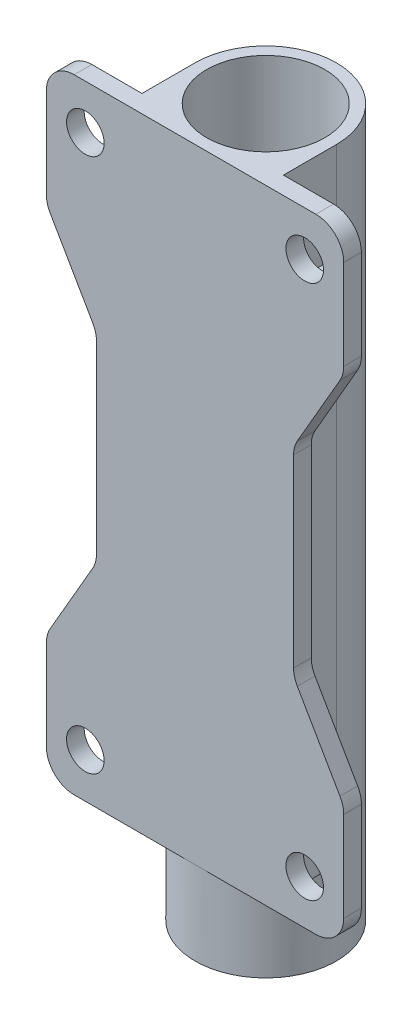
from build123d import *

# Parameters (mm, degrees)
BOSS_EXTRUDE1_START   = -224
BOSS_EXTRUDE1_DEPTH   = 224
BOSS_EXTRUDE2_DEPTH   = 6.35
BOSS_EXTRUDE3_DEPTH   = 5
M12_CLEARANCE_HOLE1_D = 13.5
FILLET1_R             = 10
MIRROR1_COPY_1_DEPTH  = 5
FILLET1_OF_MIRROR1_R  = 10


with BuildPart() as part:
    # Sketch12 → Revolve1 (revolve)
    with BuildSketch(Plane.XY, mode=Mode.PRIVATE) as revolve1_sk:
        Polygon((-25.4, 0), (-25.4, 254), (-21.22866, 254), (-21.22866, 127), (-21.22866, 0), align=None)
    revolve(revolve1_sk.sketch.rotate(Axis((0, 0, 0), (0, 1, 0)), 270), axis=Axis((0, 0, 0), (0, 1, 0)))

    # Sketch14 → Boss-Extrude1 (add)
    with BuildSketch(Plane(origin=(0, 30, 0), x_dir=(-1, 0, 0), z_dir=(0, -1, 0)).offset(BOSS_EXTRUDE1_START)):
        with BuildLine():
            Line((-25.4, 0), (-25.4, -25.4))
            Line((-25.4, -25.4), (-3.2e-08, -25.4))
            ThreePointArc((-3.2e-08, -25.4), (-17.960512254, -17.960512231), (-25.4, 0))
        make_face()
        with BuildLine():
            ThreePointArc((25.4, 0), (17.960512231, -17.960512254), (-3.2e-08, -25.4))
            Line((-3.2e-08, -25.4), (25.4, -25.4))
            Line((25.4, -25.4), (25.4, 0))
        make_face()
    extrude(amount=BOSS_EXTRUDE1_DEPTH)

    # Sketch27 → Boss-Extrude2 (add)
    with BuildSketch(Plane.XY.offset(25.4)):
        Polygon((25.4, 254), (25.4, 30), (53.4, 30), (53.4, 75), (35.4, 106.176914536), (35.4, 177.823085464), (53.4, 209), (53.4, 254), align=None)
    boss_extrude2 = extrude(amount=-BOSS_EXTRUDE2_DEPTH)

    # Sketch32 → Boss-Extrude3 (add)
    with BuildSketch(Plane(origin=(0, 65, 0), x_dir=(-1, 0, 0), z_dir=(0, -1, 0))):
        Polygon((-53.4, -19.05), (-25.4, -19.05), (-25.4, 0), align=None)
    boss_extrude3 = extrude(amount=-BOSS_EXTRUDE3_DEPTH)

    # Mirror2: Boss-Extrude3 across plane
    add(boss_extrude3.mirror(Plane(origin=(0, 142, 0), x_dir=(0, 0, 1), z_dir=(0, -1, 0))))

    # M12 Clearance Hole1 (through all)
    with Locations(Plane.XY.offset(25.4)):
        with Locations((39.4, 46), (39.4, 238)):
            m12_clearance_hole1 = Hole(M12_CLEARANCE_HOLE1_D / 2)

    # Fillet1
    fillet1_edges = [part.edges().sort_by_distance(p)[0] for p in [
        (53.4, 254, 22.225),
        (53.4, 209, 22.225),
        (35.4, 177.823085464, 22.225),
        (35.4, 106.176914536, 22.225),
        (53.4, 75, 22.225),
        (53.4, 30, 22.225),
    ]]
    fillet(fillet1_edges, radius=FILLET1_R)

    # Mirror1: Boss-Extrude2, Boss-Extrude3, M12 Clearance Hole1 across plane
    add(boss_extrude2.mirror(Plane(origin=(0, 0, 0), x_dir=(0, 0, 1), z_dir=(1, 0, 0))))
    add(boss_extrude3.mirror(Plane(origin=(0, 0, 0), x_dir=(0, 0, 1), z_dir=(1, 0, 0))))
    add(m12_clearance_hole1.mirror(Plane(origin=(0, 0, 0), x_dir=(0, 0, 1), z_dir=(1, 0, 0))), mode=Mode.SUBTRACT)

    # Mirror1 copy 1 sketch → Mirror1 copy 1 (add)
    with BuildSketch(Plane(origin=(0, 219, 0), x_dir=(1, 0, 0), z_dir=(0, 1, 0))):
        Polygon((-53.4, -19.05), (-25.4, -19.05), (-25.4, 0), align=None)
    extrude(amount=-MIRROR1_COPY_1_DEPTH)

    # Fillet1 of Mirror1
    fillet1_of_mirror1_edges = [part.edges().sort_by_distance(p)[0] for p in [
        (-53.4, 254, 22.225),
        (-53.4, 209, 22.225),
        (-35.4, 177.823085464, 22.225),
        (-35.4, 106.176914536, 22.225),
        (-53.4, 75, 22.225),
        (-53.4, 30, 22.225),
    ]]
    fillet(fillet1_of_mirror1_edges, radius=FILLET1_OF_MIRROR1_R)


solid = part.part
